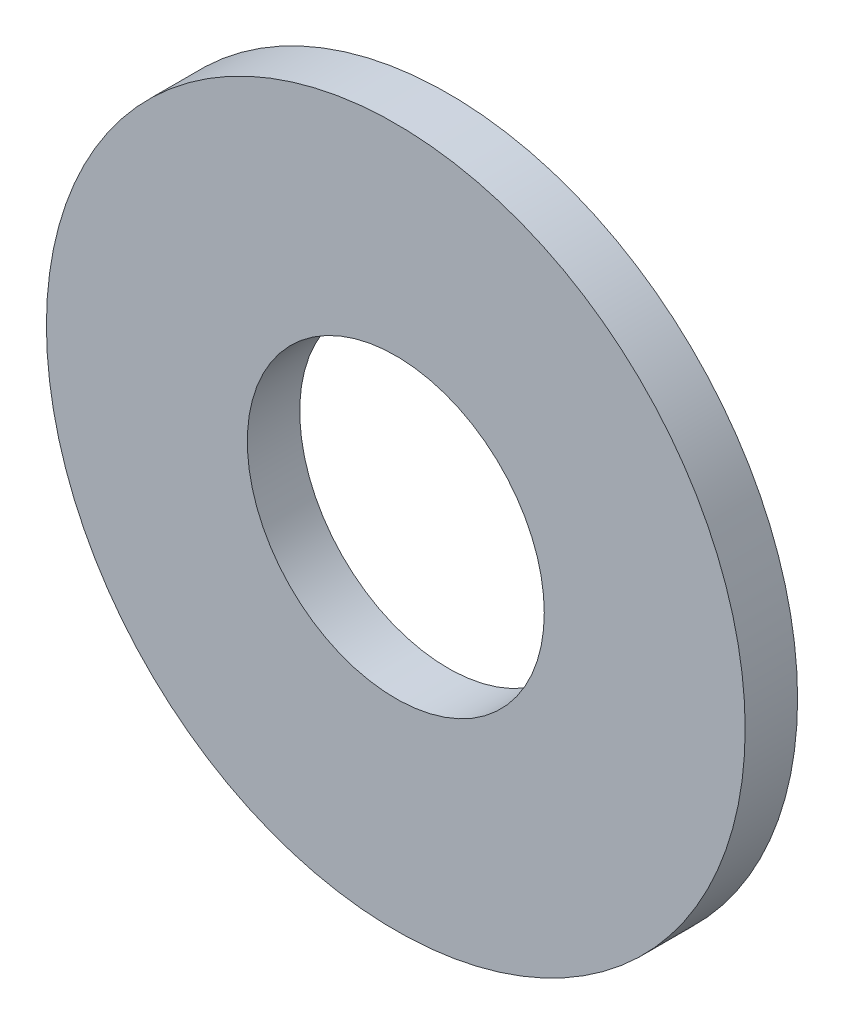
from build123d import *

# Parameters (mm, degrees)
SKETCH_1_R          = 2
EXTRUDE_182_DEPTH   = 0.3
SKETCH_2_R          = 0.85
CUT_EXTRUDE_1_DEPTH = 3.844292531


with BuildPart() as part:
    # Эскиз1 → Extrude 182 (new body)
    with BuildSketch(Plane.XY):
        Circle(SKETCH_1_R)
    extrude(amount=EXTRUDE_182_DEPTH)

    # Эскиз2 → Вырез-Вытянуть1 (cut, through all)
    with BuildSketch(Plane.XY.offset(0.3)):
        Circle(SKETCH_2_R)
    extrude(amount=-CUT_EXTRUDE_1_DEPTH, mode=Mode.SUBTRACT)


solid = part.part
